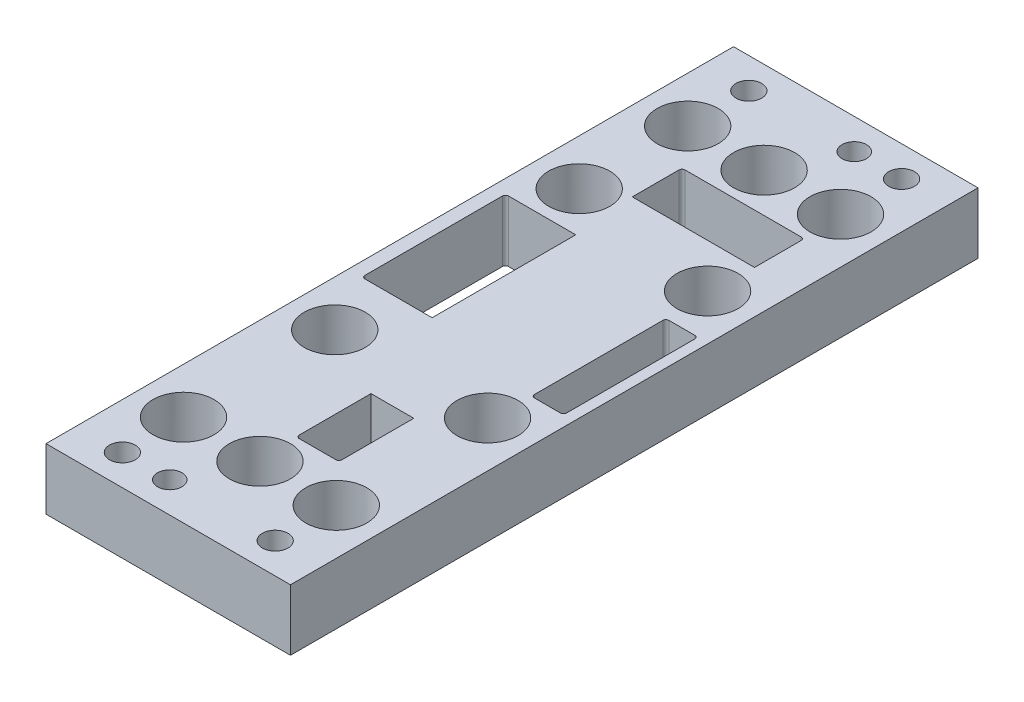
from build123d import *

# Parameters (mm, degrees)
SKETCH1_W                                           = 80
SKETCH1_H                                           = 225
BOSS_EXTRUDE1_DEPTH                                 = 20
CUT_EXTRUDE1_REACH                                  = 125.176
CUT_EXTRUDE2_REACH                                  = 125.176
CUT_EXTRUDE3_REACH                                  = 125.176
CUT_EXTRUDE4_REACH                                  = 125.176
CBORE_FOR_M8_HEX_SOCKET_HEAD_CAP_SCREW1_D           = 8.4
CBORE_FOR_M8_HEX_SOCKET_HEAD_CAP_SCREW1_CBORE_D     = 15
CBORE_FOR_M8_HEX_SOCKET_HEAD_CAP_SCREW1_CBORE_DEPTH = 8.6
F_8_0MM_DOWEL_HOLE1_D                               = 8
CUT_EXTRUDE5_REACH                                  = 125.176
SKETCH7_R                                           = 10


with BuildPart() as part:
    # Sketch1 → Boss-Extrude1 (new body)
    with BuildSketch(Plane(origin=(0, 0, 0), x_dir=(1, 0, 0), z_dir=(0, 1, 0))):
        with Locations((-6, 0)):
            Rectangle(SKETCH1_W, SKETCH1_H)
    extrude(amount=-BOSS_EXTRUDE1_DEPTH)

    # Sketch2 → Cut-Extrude1 (cut, up to next)
    with BuildSketch(Plane(origin=(0, 0, 0), x_dir=(1, 0, 0), z_dir=(0, 1, 0)), mode=Mode.PRIVATE) as cut_extrude1_sk1:
        with BuildLine():
            Line((21, -19.64), (29.5, -19.64))
            ThreePointArc((29.5, -19.64), (30.207106781, -19.347106781), (30.5, -18.64))
            Line((30.5, -18.64), (30.5, 23.36))
            ThreePointArc((30.5, 23.36), (30.207106781, 24.067106781), (29.5, 24.36))
            Line((29.5, 24.36), (21, 24.36))
            ThreePointArc((21, 24.36), (20.292893219, 24.067106781), (20, 23.36))
            Line((20, 23.36), (20, -18.64))
            ThreePointArc((20, -18.64), (20.292893219, -19.347106781), (21, -19.64))
        make_face()
    cut_extrude1_tool1 = extrude(cut_extrude1_sk1.sketch, amount=-CUT_EXTRUDE1_REACH, mode=Mode.PRIVATE) & part.part
    add(cut_extrude1_tool1.solids().sort_by_distance((25.25, 0, -2.36))[0], mode=Mode.SUBTRACT)

    # Sketch4 → Cut-Extrude2 (cut, up to next)
    with BuildSketch(Plane(origin=(0, 0, 0), x_dir=(1, 0, 0), z_dir=(0, 1, 0)), mode=Mode.PRIVATE) as cut_extrude2_sk1:
        with BuildLine():
            Line((7, -68.64), (7, -45.14))
            Line((7, -45.14), (-7, -45.14))
            Line((-7, -45.14), (-7, -68.64))
            ThreePointArc((-7, -68.64), (-6.707106781, -69.347106781), (-6, -69.64))
            Line((-6, -69.64), (6, -69.64))
            ThreePointArc((6, -69.64), (6.707106781, -69.347106781), (7, -68.64))
        make_face()
    cut_extrude2_tool1 = extrude(cut_extrude2_sk1.sketch, amount=-CUT_EXTRUDE2_REACH, mode=Mode.PRIVATE) & part.part
    add(cut_extrude2_tool1.solids().sort_by_distance((0, 0, 57.374932))[0], mode=Mode.SUBTRACT)

    # Sketch5 → Cut-Extrude3 (cut, up to next)
    with BuildSketch(Plane(origin=(0, 0, 0), x_dir=(1, 0, 0), z_dir=(0, 1, 0)), mode=Mode.PRIVATE) as cut_extrude3_sk1:
        with BuildLine():
            Line((-18.5, -13.64), (-18.5, 33.36))
            Line((-18.5, 33.36), (-40.5, 33.36))
            ThreePointArc((-40.5, 33.36), (-41.207106781, 33.067106781), (-41.5, 32.36))
            Line((-41.5, 32.36), (-41.5, -12.64))
            ThreePointArc((-41.5, -12.64), (-41.207106781, -13.347106781), (-40.5, -13.64))
            Line((-40.5, -13.64), (-18.5, -13.64))
        make_face()
    cut_extrude3_tool1 = extrude(cut_extrude3_sk1.sketch, amount=-CUT_EXTRUDE3_REACH, mode=Mode.PRIVATE) & part.part
    add(cut_extrude3_tool1.solids().sort_by_distance((-29.995521, 0, -9.86))[0], mode=Mode.SUBTRACT)

    # Sketch6 → Cut-Extrude4 (cut, up to next)
    with BuildSketch(Plane(origin=(0, 0, 0), x_dir=(1, 0, 0), z_dir=(0, 1, 0)), mode=Mode.PRIVATE) as cut_extrude4_sk1:
        with BuildLine():
            Line((19, 69.64), (-19, 69.64))
            ThreePointArc((-19, 69.64), (-19.707106781, 69.347106781), (-20, 68.64))
            Line((-20, 68.64), (-20, 53.36))
            Line((-20, 53.36), (20, 53.36))
            Line((20, 53.36), (20, 68.64))
            ThreePointArc((20, 68.64), (19.707106781, 69.347106781), (19, 69.64))
        make_face()
    cut_extrude4_tool1 = extrude(cut_extrude4_sk1.sketch, amount=-CUT_EXTRUDE4_REACH, mode=Mode.PRIVATE) & part.part
    add(cut_extrude4_tool1.solids().sort_by_distance((0, 0, -61.494779))[0], mode=Mode.SUBTRACT)

    # CBORE for M8 Hex Socket Head Cap Screw1 (through all)
    with Locations(Plane(origin=(0, -20, 0), x_dir=(-1, 0, 0), z_dir=(0, -1, 0))):
        with Locations((-19, 102.5), (31, 102.5), (-19, -102.5), (31, -102.5)):
            CounterBoreHole(CBORE_FOR_M8_HEX_SOCKET_HEAD_CAP_SCREW1_D / 2, CBORE_FOR_M8_HEX_SOCKET_HEAD_CAP_SCREW1_CBORE_D / 2, CBORE_FOR_M8_HEX_SOCKET_HEAD_CAP_SCREW1_CBORE_DEPTH)

    # Ø8.0mm Dowel Hole1 (through all)
    with Locations(Plane(origin=(0, -20, 0), x_dir=(-1, 0, 0), z_dir=(0, -1, 0))):
        with Locations((-3.5, 102.5), (15.5, -102.5)):
            Hole(F_8_0MM_DOWEL_HOLE1_D / 2)

    # Sketch7 → Cut-Extrude5 (cut, up to next)
    with BuildSketch(Plane(origin=(0, 0, 0), x_dir=(1, 0, 0), z_dir=(0, 1, 0)), mode=Mode.PRIVATE) as cut_extrude5_sk1:
        with Locations(Location((-31, -33, 0), (0, 0, 270))):
            Circle(SKETCH7_R)
    cut_extrude5_tool1 = extrude(cut_extrude5_sk1.sketch, amount=-CUT_EXTRUDE5_REACH, mode=Mode.PRIVATE) & part.part
    # Sketch7 → Cut-Extrude5 (cut, up to next)
    with BuildSketch(Plane(origin=(0, 0, 0), x_dir=(1, 0, 0), z_dir=(0, 1, 0)), mode=Mode.PRIVATE) as cut_extrude5_sk2:
        with Locations(Location((-6, 82.5, 0), (0, 0, 270))):
            Circle(SKETCH7_R)
    cut_extrude5_tool2 = extrude(cut_extrude5_sk2.sketch, amount=-CUT_EXTRUDE5_REACH, mode=Mode.PRIVATE) & part.part
    # Sketch7 → Cut-Extrude5 (cut, up to next)
    with BuildSketch(Plane(origin=(0, 0, 0), x_dir=(1, 0, 0), z_dir=(0, 1, 0)), mode=Mode.PRIVATE) as cut_extrude5_sk3:
        with Locations(Location((19, -33, 0), (0, 0, 270))):
            Circle(SKETCH7_R)
    cut_extrude5_tool3 = extrude(cut_extrude5_sk3.sketch, amount=-CUT_EXTRUDE5_REACH, mode=Mode.PRIVATE) & part.part
    # Sketch7 → Cut-Extrude5 (cut, up to next)
    with BuildSketch(Plane(origin=(0, 0, 0), x_dir=(1, 0, 0), z_dir=(0, 1, 0)), mode=Mode.PRIVATE) as cut_extrude5_sk4:
        with Locations(Location((-31, 47, 0), (0, 0, 270))):
            Circle(SKETCH7_R)
    cut_extrude5_tool4 = extrude(cut_extrude5_sk4.sketch, amount=-CUT_EXTRUDE5_REACH, mode=Mode.PRIVATE) & part.part
    # Sketch7 → Cut-Extrude5 (cut, up to next)
    with BuildSketch(Plane(origin=(0, 0, 0), x_dir=(1, 0, 0), z_dir=(0, 1, 0)), mode=Mode.PRIVATE) as cut_extrude5_sk5:
        with Locations(Location((19, 39, 0), (0, 0, 270))):
            Circle(SKETCH7_R)
    cut_extrude5_tool5 = extrude(cut_extrude5_sk5.sketch, amount=-CUT_EXTRUDE5_REACH, mode=Mode.PRIVATE) & part.part
    # Sketch7 → Cut-Extrude5 (cut, up to next)
    with BuildSketch(Plane(origin=(0, 0, 0), x_dir=(1, 0, 0), z_dir=(0, 1, 0)), mode=Mode.PRIVATE) as cut_extrude5_sk6:
        with Locations(Location((-31, -82.5, 0), (0, 0, 270))):
            Circle(SKETCH7_R)
    cut_extrude5_tool6 = extrude(cut_extrude5_sk6.sketch, amount=-CUT_EXTRUDE5_REACH, mode=Mode.PRIVATE) & part.part
    # Sketch7 → Cut-Extrude5 (cut, up to next)
    with BuildSketch(Plane(origin=(0, 0, 0), x_dir=(1, 0, 0), z_dir=(0, 1, 0)), mode=Mode.PRIVATE) as cut_extrude5_sk7:
        with Locations(Location((-6, -82.5, 0), (0, 0, 270))):
            Circle(SKETCH7_R)
    cut_extrude5_tool7 = extrude(cut_extrude5_sk7.sketch, amount=-CUT_EXTRUDE5_REACH, mode=Mode.PRIVATE) & part.part
    # Sketch7 → Cut-Extrude5 (cut, up to next)
    with BuildSketch(Plane(origin=(0, 0, 0), x_dir=(1, 0, 0), z_dir=(0, 1, 0)), mode=Mode.PRIVATE) as cut_extrude5_sk8:
        with Locations(Location((19, -82.5, 0), (0, 0, 270))):
            Circle(SKETCH7_R)
    cut_extrude5_tool8 = extrude(cut_extrude5_sk8.sketch, amount=-CUT_EXTRUDE5_REACH, mode=Mode.PRIVATE) & part.part
    # Sketch7 → Cut-Extrude5 (cut, up to next)
    with BuildSketch(Plane(origin=(0, 0, 0), x_dir=(1, 0, 0), z_dir=(0, 1, 0)), mode=Mode.PRIVATE) as cut_extrude5_sk9:
        with Locations(Location((-31, 82.5, 0), (0, 0, 270))):
            Circle(SKETCH7_R)
    cut_extrude5_tool9 = extrude(cut_extrude5_sk9.sketch, amount=-CUT_EXTRUDE5_REACH, mode=Mode.PRIVATE) & part.part
    # Sketch7 → Cut-Extrude5 (cut, up to next)
    with BuildSketch(Plane(origin=(0, 0, 0), x_dir=(1, 0, 0), z_dir=(0, 1, 0)), mode=Mode.PRIVATE) as cut_extrude5_sk10:
        with Locations(Location((19, 82.5, 0), (0, 0, 270))):
            Circle(SKETCH7_R)
    cut_extrude5_tool10 = extrude(cut_extrude5_sk10.sketch, amount=-CUT_EXTRUDE5_REACH, mode=Mode.PRIVATE) & part.part
    add(cut_extrude5_tool1.solids().sort_by_distance((-31, 0, 33))[0], mode=Mode.SUBTRACT)
    add(cut_extrude5_tool2.solids().sort_by_distance((-6, 0, -82.5))[0], mode=Mode.SUBTRACT)
    add(cut_extrude5_tool3.solids().sort_by_distance((19, 0, 33))[0], mode=Mode.SUBTRACT)
    add(cut_extrude5_tool4.solids().sort_by_distance((-31, 0, -47))[0], mode=Mode.SUBTRACT)
    add(cut_extrude5_tool5.solids().sort_by_distance((19, 0, -39))[0], mode=Mode.SUBTRACT)
    add(cut_extrude5_tool6.solids().sort_by_distance((-31, 0, 82.5))[0], mode=Mode.SUBTRACT)
    add(cut_extrude5_tool7.solids().sort_by_distance((-6, 0, 82.5))[0], mode=Mode.SUBTRACT)
    add(cut_extrude5_tool8.solids().sort_by_distance((19, 0, 82.5))[0], mode=Mode.SUBTRACT)
    add(cut_extrude5_tool9.solids().sort_by_distance((-31, 0, -82.5))[0], mode=Mode.SUBTRACT)
    add(cut_extrude5_tool10.solids().sort_by_distance((19, 0, -82.5))[0], mode=Mode.SUBTRACT)


solid = part.part
